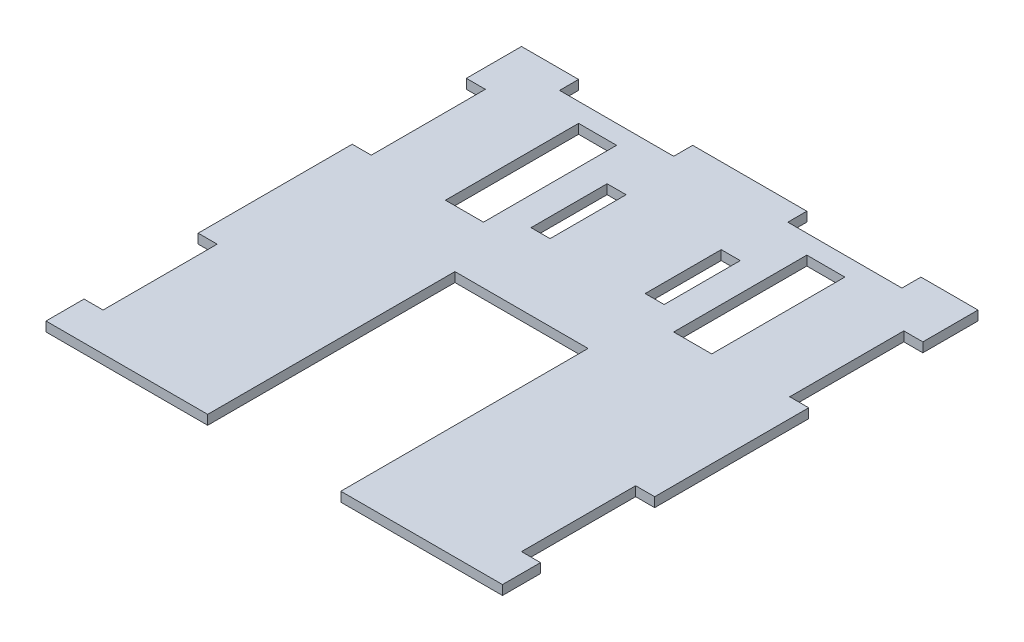
from build123d import *

# Parameters (mm, degrees)
BOSS_EXTRUDE1_DEPTH = 6.35
SKETCH2_W           = 12.7
SKETCH2_H           = 76.2
SKETCH2_W_2         = 76.2
SKETCH2_H_2         = 12.7
SKETCH2_W_3         = 25.4
SKETCH2_H_3         = 88.9
CUT_EXTRUDE1_DEPTH  = 286.467638271
SKETCH3_W           = 12.7
SKETCH3_H           = 50.8
CUT_EXTRUDE2_DEPTH  = 286.467638271


with BuildPart() as part:
    # Sketch1 → Boss-Extrude1 (new body)
    with BuildSketch(Plane(origin=(0, 0, 0), x_dir=(1, 0, 0), z_dir=(0, 1, 0))):
        Polygon((-152.4, 76.2), (-152.4, -241.3), (-44.45, -241.3), (-44.45, -76.2), (44.45, -76.2), (44.45, -241.3), (152.4, -241.3), (152.4, 76.2), align=None)
    extrude(amount=BOSS_EXTRUDE1_DEPTH)

    # Sketch2 → Cut-Extrude1 (cut, through all)
    with BuildSketch(Plane(origin=(0, 6.35, 0), x_dir=(1, 0, 0), z_dir=(0, 1, 0))):
        with Locations((146.05, 1.27)):
            Rectangle(SKETCH2_W, SKETCH2_H)
        with Locations((146.05, -177.8)):
            Rectangle(SKETCH2_W, SKETCH2_H)
        with Locations((-146.05, -177.8)):
            Rectangle(SKETCH2_W, SKETCH2_H)
        with Locations((-146.05, 1.27)):
            Rectangle(SKETCH2_W, SKETCH2_H)
        with Locations((-76.2, 69.85)):
            Rectangle(SKETCH2_W_2, SKETCH2_H_2)
        with Locations((76.2, 69.85)):
            Rectangle(SKETCH2_W_2, SKETCH2_H_2)
        with Locations((-76.2, 6.35)):
            Rectangle(SKETCH2_W_3, SKETCH2_H_3)
        with Locations((76.2, 6.35)):
            Rectangle(SKETCH2_W_3, SKETCH2_H_3)
    extrude(amount=-CUT_EXTRUDE1_DEPTH, mode=Mode.SUBTRACT)

    # Sketch3 → Cut-Extrude2 (cut, through all)
    with BuildSketch(Plane(origin=(0, 6.35, 0), x_dir=(1, 0, 0), z_dir=(0, 1, 0))):
        with Locations((-38.1, 0)):
            Rectangle(SKETCH3_W, SKETCH3_H)
        with Locations((38.1, 0)):
            Rectangle(SKETCH3_W, SKETCH3_H)
    extrude(amount=-CUT_EXTRUDE2_DEPTH, mode=Mode.SUBTRACT)


solid = part.part
